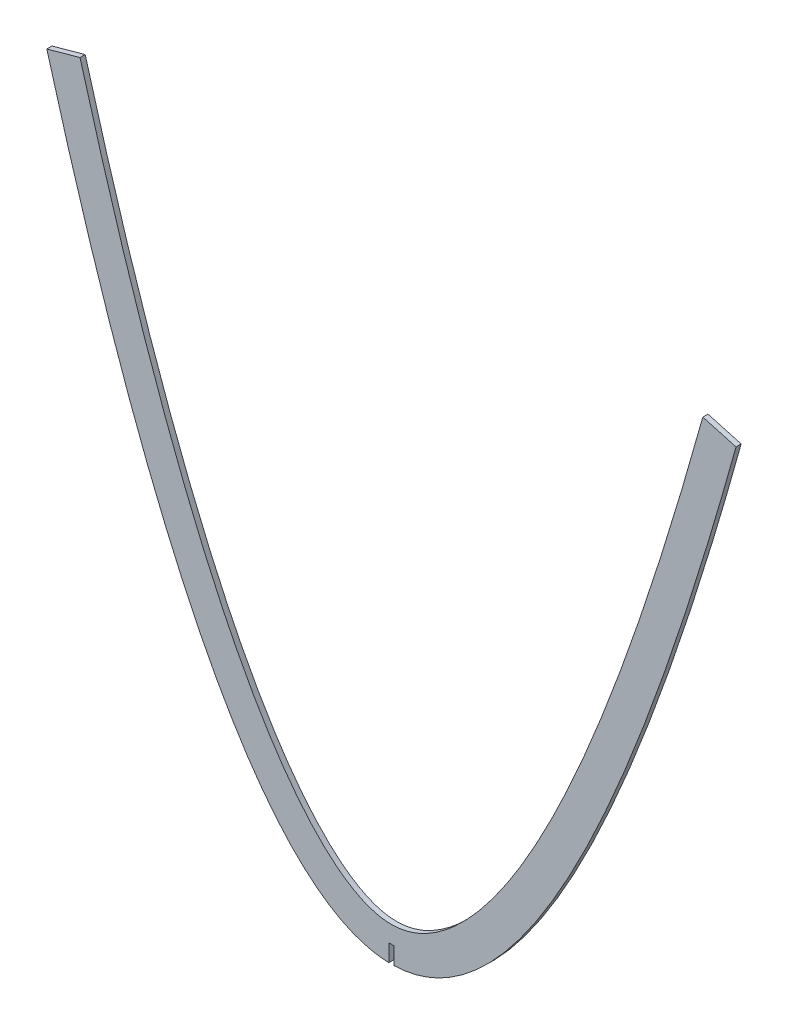
from build123d import *

# Parameters (mm, degrees)
BOSS_EXTRUDE1_DEPTH = 3
CUT_EXTRUDE1_DEPTH  = 417.523378753


with BuildPart() as part:
    # Sketch1 → Boss-Extrude1 (new body)
    with BuildSketch(Plane.XY):
        with BuildLine():
            Line((-200, 360.000000001), (-180.729641808, 365.352877276))
            add(Edge.make_bspline(
                [(-180.729641808, 365.352877276), (-162.10162266, 298.30776658), (-131.224543005, 208.005364049), (-106.686733527, 147.290826567), (-82.445208054, 98.231831122), (-58.77685397, 61.021055693), (-39.13105929, 39.02109443), (-26.209054459, 28.885486775), (-16.683358121, 23.558894303), (-8.032448443, 20.668588236), (0, 19.777137255), (8.032448443, 20.668588236), (16.683358121, 23.558894303), (26.209054459, 28.885486775), (39.13105929, 39.02109443), (58.77685397, 61.021055693), (82.445208054, 98.231831121), (106.686733527, 147.290826566), (131.224543005, 208.005364048), (162.10162266, 298.307766579), (180.729641807, 365.352877275)],
                knots=[0.049339511, 0.049339511, 0.049339511, 0.133838353, 0.190170914, 0.246503475, 0.302836036, 0.359168597, 0.401418018, 0.429584299, 0.457750579, 0.48591686, 0.51408314, 0.542249421, 0.570415701, 0.598581982, 0.640831403, 0.697163964, 0.753496525, 0.809829086, 0.866161647, 0.950660489, 0.950660489, 0.950660489], degree=2))
            Line((180.729641807, 365.352877275), (200, 360))
            add(Edge.make_bspline(
                [(-200, 360.000000001), (0, -360), (200, 360)],
                knots=[0.049339511, 0.049339511, 0.049339511, 0.950660489, 0.950660489, 0.950660489], degree=2))
        make_face()
    extrude(amount=BOSS_EXTRUDE1_DEPTH)

    # Sketch3 → Cut-Extrude1 (cut, through all)
    with BuildSketch(Plane.XY.offset(3)):
        Polygon((0, 0), (-1.5, 0), (-1.5, 10), (1.5, 10), (1.5, 0), align=None)
    extrude(amount=-CUT_EXTRUDE1_DEPTH, mode=Mode.SUBTRACT)


solid = part.part
